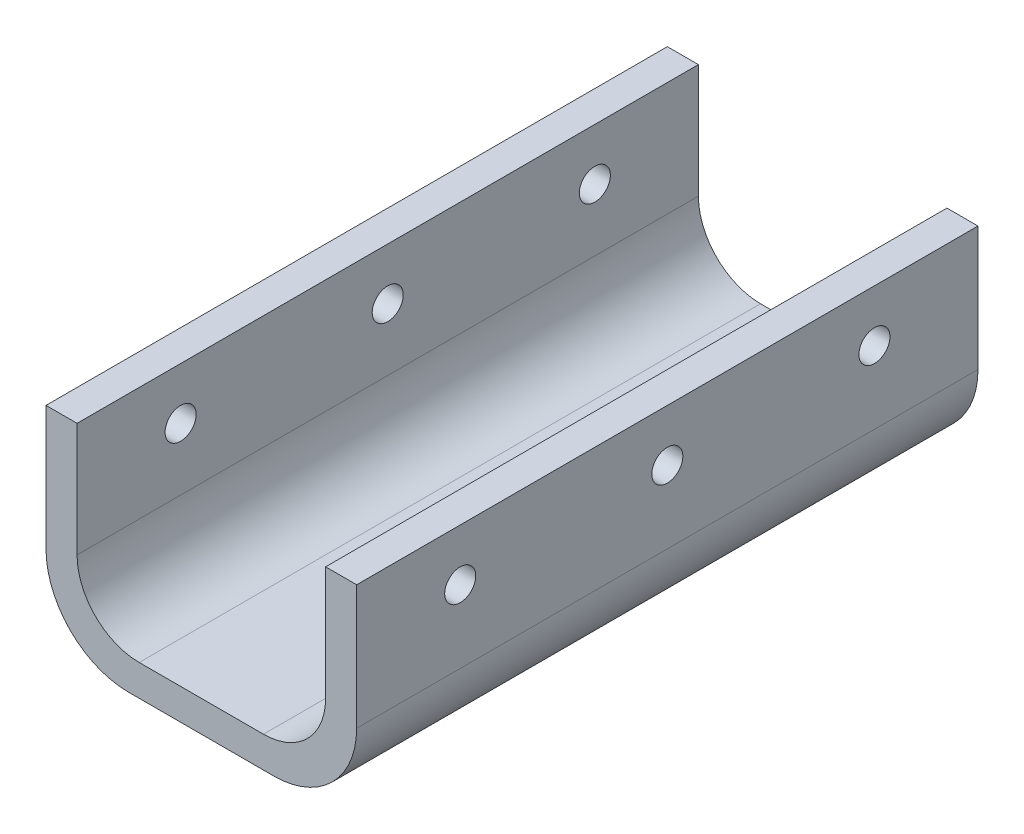
from build123d import *

# Parameters (mm, degrees)
EXTRUDE_1_DEPTH     = 200
FILLET_1_R          = 8
FILLET_2_R          = 6
SKETCH_2_R          = 1.5
CUT_EXTRUDE_1_DEPTH = 203.484567313
SKETCH_3_W          = 63.1289962
SKETCH_3_H          = 24.316742519
CUT_EXTRUDE_2_DEPTH = 59
CUT_EXTRUDE_START   = -40
CUT_EXTRUDE_3_DEPTH = 40
CUT_EXTRUDE_4_DEPTH = 40


with BuildPart() as part:
    # 草图1 → 凸台-拉伸1 (new body)
    with BuildSketch(Plane.XY):
        Polygon((12, -7), (12, 10), (15, 10), (15, -10), (-15, -10), (-15, 10), (-12, 10), (-12, -7), align=None)
    extrude(amount=EXTRUDE_1_DEPTH)

    # 圆角1
    fillet_1_edges = [part.edges().sort_by_distance(p)[0] for p in [
        (15, -10, 100),
        (-15, -10, 100),
    ]]
    fillet(fillet_1_edges, radius=FILLET_1_R)

    # 圆角2
    fillet_2_edges = [part.edges().sort_by_distance(p)[0] for p in [
        (-12, -7, 100),
        (12, -7, 100),
    ]]
    fillet(fillet_2_edges, radius=FILLET_2_R)

    # 草图2 → 切除-拉伸1 (cut, through all)
    with BuildSketch(Plane.ZY.offset(15)):
        with Locations((90, 5)):
            Circle(SKETCH_2_R)
        with Locations((70, 5)):
            Circle(SKETCH_2_R)
        with Locations((50, 5)):
            Circle(SKETCH_2_R)
        with Locations((30, 5)):
            Circle(SKETCH_2_R)
        with Locations((10, 5)):
            Circle(SKETCH_2_R)
        with Locations(Location((190, 5, 0), (0, 0, 180))):
            Circle(SKETCH_2_R)
        with Locations(Location((170, 5, 0), (0, 0, 180))):
            Circle(SKETCH_2_R)
        with Locations(Location((150, 5, 0), (0, 0, 180))):
            Circle(SKETCH_2_R)
        with Locations(Location((130, 5, 0), (0, 0, 180))):
            Circle(SKETCH_2_R)
        with Locations(Location((110, 5, 0), (0, 0, 180))):
            Circle(SKETCH_2_R)
    extrude(amount=-CUT_EXTRUDE_1_DEPTH, mode=Mode.SUBTRACT)

    # 草图3 → 切除-拉伸2 (cut)
    with BuildSketch(Plane.ZY.offset(15)):
        with Locations((171.5644981, -2.15837126)):
            Rectangle(SKETCH_3_W, SKETCH_3_H)
    extrude(amount=-CUT_EXTRUDE_2_DEPTH, mode=Mode.SUBTRACT)

    # 草图4 → 切除-拉伸3 (cut)
    with BuildSketch(Plane(origin=(0, 0, 0), x_dir=(-1, 0, 0), z_dir=(0, 0, -1)).offset(CUT_EXTRUDE_START)):
        with BuildLine():
            Line((-15, 10), (-15, -2))
            ThreePointArc((-15, -2), (-12.656854249, -7.656854249), (-7, -10))
            Line((-7, -10), (7, -10))
            ThreePointArc((7, -10), (12.656854249, -7.656854249), (15, -2))
            Line((15, -2), (15, 10))
            Line((15, 10), (12, 10))
            Line((12, 10), (12, -1))
            ThreePointArc((12, -1), (10.242640687, -5.242640687), (6, -7))
            Line((6, -7), (-6, -7))
            ThreePointArc((-6, -7), (-10.242640687, -5.242640687), (-12, -1))
            Line((-12, -1), (-12, 10))
            Line((-12, 10), (-15, 10))
        make_face()
    extrude(amount=CUT_EXTRUDE_3_DEPTH, mode=Mode.SUBTRACT)

    # 草图5 → 切除-拉伸4 (cut)
    with BuildSketch(Plane.XY.offset(140)):
        with BuildLine():
            Line((15, 10), (12, 10))
            Line((12, 10), (12, -1))
            ThreePointArc((12, -1), (10.242640687, -5.242640687), (6, -7))
            Line((6, -7), (-6, -7))
            ThreePointArc((-6, -7), (-10.242640687, -5.242640687), (-12, -1))
            Line((-12, -1), (-12, 10))
            Line((-12, 10), (-15, 10))
            Line((-15, 10), (-15, -2))
            ThreePointArc((-15, -2), (-12.656854249, -7.656854249), (-7, -10))
            Line((-7, -10), (7, -10))
            ThreePointArc((7, -10), (12.656854249, -7.656854249), (15, -2))
            Line((15, -2), (15, 10))
        make_face()
    extrude(amount=-CUT_EXTRUDE_4_DEPTH, mode=Mode.SUBTRACT)


solid = part.part
